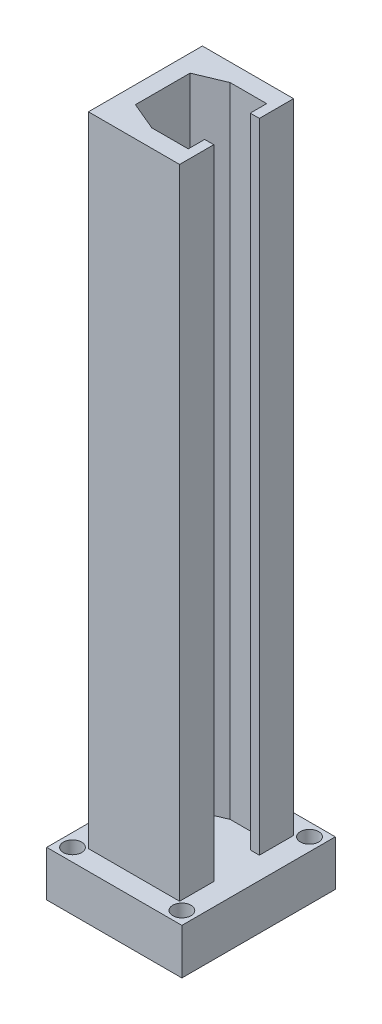
from build123d import *

# Parameters (mm, degrees)
BOSS_EXTRUDE2_DEPTH = 150
SKETCH3_W           = 29.65685425
SKETCH3_H           = 33.65685425
SKETCH3_R           = 2
BOSS_EXTRUDE3_DEPTH = 10


with BuildPart() as part:
    # Sketch1 → Boss-Extrude2 (new body)
    with BuildSketch(Plane(origin=(0, 0, 0), x_dir=(1, 0, 0), z_dir=(0, 1, 0))):
        Polygon((-10, 12.5), (-10, -12.5), (10, -12.5), (10, -5), (8, -5), (8, -8.6), (0, -8.6), (-6.2, -6), (-6.2, 0), (-6.2, 6), (0, 8.6), (8, 8.6), (8, 5), (10, 5), (10, 12.5), align=None)
    extrude(amount=BOSS_EXTRUDE2_DEPTH)

    # Sketch3 → Boss-Extrude3 (add)
    with BuildSketch(Plane(origin=(0, 0, 0), x_dir=(1, 0, 0), z_dir=(0, 1, 0))):
        Rectangle(SKETCH3_W, SKETCH3_H)
        with Locations(Location((-12, 14, 0), (0, 0, 270))):
            Circle(SKETCH3_R, mode=Mode.SUBTRACT)
        with Locations(Location((-12, -14, 0), (0, 0, 270))):
            Circle(SKETCH3_R, mode=Mode.SUBTRACT)
        with Locations(Location((12, 14, 0), (0, 0, 90))):
            Circle(SKETCH3_R, mode=Mode.SUBTRACT)
        with Locations(Location((12, -14, 0), (0, 0, 90))):
            Circle(SKETCH3_R, mode=Mode.SUBTRACT)
    extrude(amount=BOSS_EXTRUDE3_DEPTH)


solid = part.part
